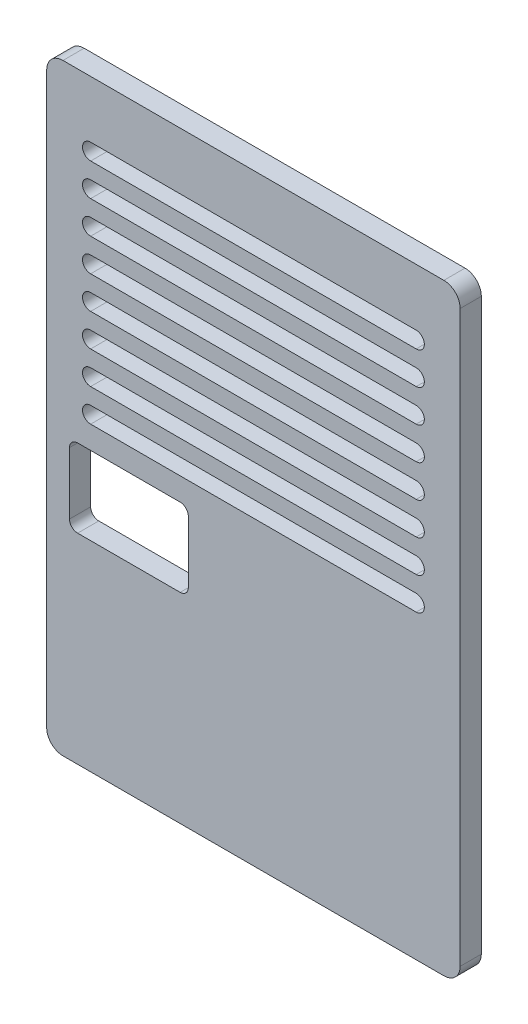
from build123d import *

# Parameters (mm, degrees)
SKETCH1_W           = 63.5
SKETCH1_H           = 92.5
BOSS_EXTRUDE1_DEPTH = 1.5
BOSS_EXTRUDE2_START = 1.5
SKETCH1_2_W         = 63.5
SKETCH1_2_H         = 92.5
BOSS_EXTRUDE2_DEPTH = 1.75
SKETCH3_W           = 18.25
SKETCH3_H           = 12
CUT_EXTRUDE1_DEPTH  = 57.193304761
FILLET1_R           = 2.5
FILLET2_R           = 1.25
CUT_EXTRUDE2_DEPTH  = 57.193304761
SKETCH5_W           = 45.209659229
SKETCH5_H           = 5
BOSS_EXTRUDE3_DEPTH = 5.5
FILLET3_R           = 2.5


with BuildPart() as part:
    # Sketch1 → Boss-Extrude1 (new body)
    with BuildSketch(Plane.XY):
        Rectangle(SKETCH1_W, SKETCH1_H)
        with BuildLine():
            Line((-27, 43.9), (-13.75, 43.9))
            ThreePointArc((-13.75, 43.9), (-13.502512627, 44.002512627), (-13.4, 44.25))
            Line((-13.4, 44.25), (-13.4, 45))
            ThreePointArc((-13.4, 45), (-13.502512627, 45.247487373), (-13.75, 45.35))
            Line((-13.75, 45.35), (-28, 45.35))
            ThreePointArc((-28, 45.35), (-30.015254326, 44.515254326), (-30.85, 42.5))
            Line((-30.85, 42.5), (-30.85, 39.25))
            ThreePointArc((-30.85, 39.25), (-30.747487373, 39.002512627), (-30.5, 38.9))
            Line((-30.5, 38.9), (-29.75, 38.9))
            ThreePointArc((-29.75, 38.9), (-29.502512627, 39.002512627), (-29.4, 39.25))
            Line((-29.4, 39.25), (-29.4, 41.5))
            ThreePointArc((-29.4, 41.5), (-28.697056275, 43.197056275), (-27, 43.9))
        make_face(mode=Mode.SUBTRACT)
        with BuildLine():
            Line((30.85, -42.5), (30.85, 42.5))
            ThreePointArc((30.85, 42.5), (30.015254326, 44.515254326), (28, 45.35))
            Line((28, 45.35), (13.75, 45.35))
            ThreePointArc((13.75, 45.35), (13.502512627, 45.247487373), (13.4, 45))
            Line((13.4, 45), (13.4, 44.25))
            ThreePointArc((13.4, 44.25), (13.502512627, 44.002512627), (13.75, 43.9))
            Line((13.75, 43.9), (27, 43.9))
            ThreePointArc((27, 43.9), (28.697056275, 43.197056275), (29.4, 41.5))
            Line((29.4, 41.5), (29.4, -41.550510257))
            ThreePointArc((29.4, -41.550510257), (28.914537685, -42.997764711), (27.654545455, -43.859529583))
            ThreePointArc((27.654545455, -43.859529583), (27.470796588, -43.985203627), (27.4, -44.196261568))
            Line((27.4, -44.196261568), (27.4, -45))
            ThreePointArc((27.4, -45), (27.502512627, -45.247487373), (27.75, -45.35))
            Line((27.75, -45.35), (28, -45.35))
            ThreePointArc((28, -45.35), (30.015254326, -44.515254326), (30.85, -42.5))
        make_face(mode=Mode.SUBTRACT)
        with BuildLine():
            Line((-29.4, -41.550510257), (-29.4, -3.25))
            ThreePointArc((-29.4, -3.25), (-29.502512627, -3.002512627), (-29.75, -2.9))
            Line((-29.75, -2.9), (-30.5, -2.9))
            ThreePointArc((-30.5, -2.9), (-30.747487373, -3.002512627), (-30.85, -3.25))
            Line((-30.85, -3.25), (-30.85, -42.5))
            ThreePointArc((-30.85, -42.5), (-30.015254326, -44.515254326), (-28, -45.35))
            Line((-28, -45.35), (-27.75, -45.35))
            ThreePointArc((-27.75, -45.35), (-27.502512627, -45.247487373), (-27.4, -45))
            Line((-27.4, -45), (-27.4, -44.196261568))
            ThreePointArc((-27.4, -44.196261568), (-27.470796588, -43.985203627), (-27.654545455, -43.859529583))
            ThreePointArc((-27.654545455, -43.859529583), (-28.914537685, -42.997764711), (-29.4, -41.550510257))
        make_face(mode=Mode.SUBTRACT)
    extrude(amount=BOSS_EXTRUDE1_DEPTH)

    # Sketch1<2> → Boss-Extrude2 (add)
    with BuildSketch(Plane.XY.offset(BOSS_EXTRUDE2_START)):
        Rectangle(SKETCH1_2_W, SKETCH1_2_H)
    extrude(amount=BOSS_EXTRUDE2_DEPTH)

    # Sketch3 → Cut-Extrude1 (cut, through all)
    with BuildSketch(Plane.XY.offset(3.25)):
        with Locations((-19.125, -9.5)):
            Rectangle(SKETCH3_W, SKETCH3_H)
    extrude(amount=-CUT_EXTRUDE1_DEPTH, mode=Mode.SUBTRACT)

    # Fillet1
    fillet1_edges = [part.edges().sort_by_distance(p)[0] for p in [
        (-31.75, 46.25, 1.625),
        (31.75, 46.25, 1.625),
        (31.75, -46.25, 1.625),
        (-31.75, -46.25, 1.625),
    ]]
    fillet(fillet1_edges, radius=FILLET1_R)

    # Fillet2
    fillet2_edges = [part.edges().sort_by_distance(p)[0] for p in [
        (-28.25, -15.5, 1.625),
        (-28.25, -3.5, 1.625),
        (-10, -3.5, 1.625),
        (-10, -15.5, 1.625),
    ]]
    fillet(fillet2_edges, radius=FILLET2_R)

    # Sketch4 → Cut-Extrude2 (cut, through all)
    with BuildSketch(Plane.XY.offset(3.25)):
        with BuildLine():
            Line((-25, 37.5), (25, 37.5))
            ThreePointArc((25, 37.5), (26.25, 36.25), (25, 35))
            Line((25, 35), (-25, 35))
            ThreePointArc((-25, 35), (-26.25, 36.25), (-25, 37.5))
        make_face()
        with BuildLine():
            Line((-25, 32.5), (25, 32.5))
            ThreePointArc((25, 32.5), (26.25, 31.25), (25, 30))
            Line((25, 30), (-25, 30))
            ThreePointArc((-25, 30), (-26.25, 31.25), (-25, 32.5))
        make_face()
        with BuildLine():
            Line((-25, 27.5), (25, 27.5))
            ThreePointArc((25, 27.5), (26.25, 26.25), (25, 25))
            Line((25, 25), (-25, 25))
            ThreePointArc((-25, 25), (-26.25, 26.25), (-25, 27.5))
        make_face()
        with BuildLine():
            Line((-25, 22.5), (25, 22.5))
            ThreePointArc((25, 22.5), (26.25, 21.25), (25, 20))
            Line((25, 20), (-25, 20))
            ThreePointArc((-25, 20), (-26.25, 21.25), (-25, 22.5))
        make_face()
        with BuildLine():
            Line((-25, 17.5), (25, 17.5))
            ThreePointArc((25, 17.5), (26.25, 16.25), (25, 15))
            Line((25, 15), (-25, 15))
            ThreePointArc((-25, 15), (-26.25, 16.25), (-25, 17.5))
        make_face()
        with BuildLine():
            Line((-25, 12.5), (25, 12.5))
            ThreePointArc((25, 12.5), (26.25, 11.25), (25, 10))
            Line((25, 10), (-25, 10))
            ThreePointArc((-25, 10), (-26.25, 11.25), (-25, 12.5))
        make_face()
        with BuildLine():
            Line((-25, 7.5), (25, 7.5))
            ThreePointArc((25, 7.5), (26.25, 6.25), (25, 5))
            Line((25, 5), (-25, 5))
            ThreePointArc((-25, 5), (-26.25, 6.25), (-25, 7.5))
        make_face()
        with BuildLine():
            Line((-25, 2.5), (25, 2.5))
            ThreePointArc((25, 2.5), (26.25, 1.25), (25, 0))
            Line((25, 0), (-25, 0))
            ThreePointArc((-25, 0), (-26.25, 1.25), (-25, 2.5))
        make_face()
    extrude(amount=-CUT_EXTRUDE2_DEPTH, mode=Mode.SUBTRACT)

    # Sketch5 → Boss-Extrude3 (add)
    with BuildSketch(Plane(origin=(0, 0, 0), x_dir=(-1, 0, 0), z_dir=(0, 0, -1))):
        with Locations((1.138073126, -43.75)):
            Rectangle(SKETCH5_W, SKETCH5_H)
    extrude(amount=BOSS_EXTRUDE3_DEPTH)

    # Fillet3
    fillet3_edges = [part.edges().sort_by_distance(p)[0] for p in [
        (-23.74290274, -43.75, 0),
        (-1.138073126, -41.25, 0),
        (21.466756489, -43.75, 0),
    ]]
    fillet(fillet3_edges, radius=FILLET3_R)


solid = part.part
